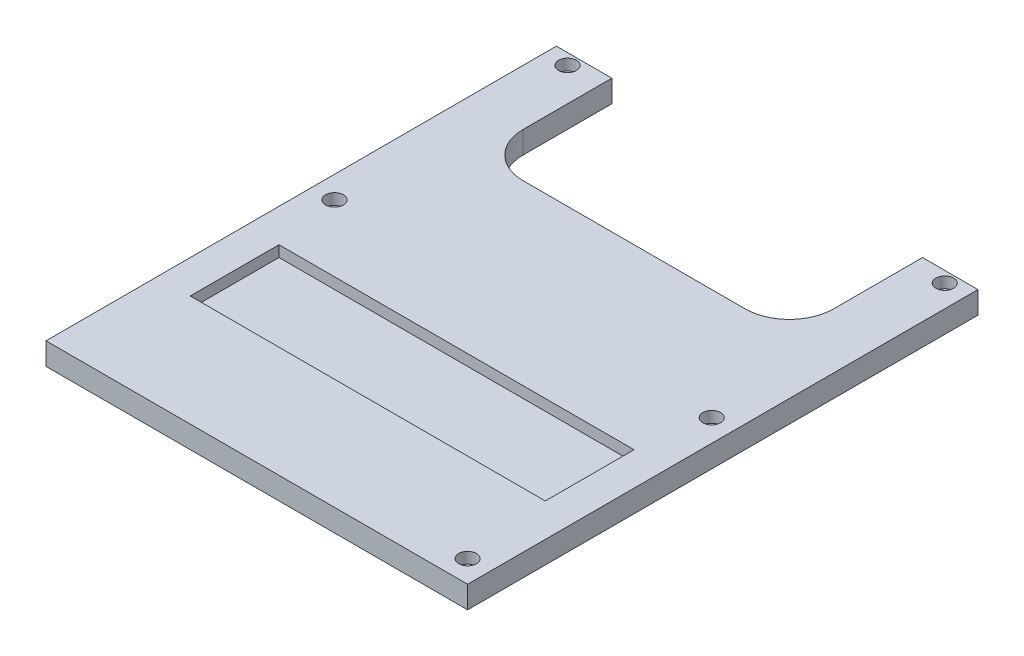
from build123d import *

# Parameters (mm, degrees)
SKETCH1_W                       = 120.65
SKETCH1_H                       = 146.05
BOSS_EXTRUDE1_DEPTH             = 6.35
SKETCH7_R                       = 2.54
CUT_EXTRUDE1_DEPTH              = 3.175
F_2_CLEARANCE_HOLE2_D           = 2.159
F_2_CLEARANCE_HOLE2_CSINK_D     = 3.429
F_2_CLEARANCE_HOLE2_CSINK_ANGLE = 75
SKETCH13_W                      = 88.9
SKETCH13_H                      = 38.1
CUT_EXTRUDE3_DEPTH              = 95.931969062
FILLET1_R                       = 12.7
SKETCH11_W                      = 101.6
SKETCH11_H                      = 25.4
CUT_EXTRUDE2_DEPTH              = 3.175


with BuildPart() as part:
    # Sketch1 → Boss-Extrude1 (new body)
    with BuildSketch(Plane(origin=(0, 0, 0), x_dir=(1, 0, 0), z_dir=(0, 1, 0))):
        Rectangle(SKETCH1_W, SKETCH1_H)
    extrude(amount=BOSS_EXTRUDE1_DEPTH)

    # Sketch7 → Cut-Extrude1 (cut)
    with BuildSketch(Plane(origin=(0, 6.35, 0), x_dir=(1, 0, 0), z_dir=(0, 1, 0))):
        with Locations(Location((-53.975, 3.175, 0), (0, 0, 270))):
            Circle(SKETCH7_R)
        with Locations(Location((53.975, 3.175, 0), (0, 0, 270))):
            Circle(SKETCH7_R)
        with Locations(Location((53.975, -66.675, 0), (0, 0, 270))):
            Circle(SKETCH7_R)
        with Locations(Location((-53.975, 69.85, 0), (0, 0, 270))):
            Circle(SKETCH7_R)
        with Locations(Location((53.975, 69.85, 0), (0, 0, 270))):
            Circle(SKETCH7_R)
    extrude(amount=-CUT_EXTRUDE1_DEPTH, mode=Mode.SUBTRACT)

    # #2 Clearance Hole2 (through all)
    with Locations(Plane(origin=(0, 3.175, 0), x_dir=(1, 0, 0), z_dir=(0, 1, 0))):
        with Locations((-53.975, 3.175), (53.975, 3.175), (53.975, -66.675), (-53.975, 69.85), (53.975, 69.85)):
            CounterSinkHole(F_2_CLEARANCE_HOLE2_D / 2, F_2_CLEARANCE_HOLE2_CSINK_D / 2, counter_sink_angle=F_2_CLEARANCE_HOLE2_CSINK_ANGLE)

    # Sketch13 → Cut-Extrude3 (cut, through all)
    with BuildSketch(Plane(origin=(0, 6.35, 0), x_dir=(1, 0, 0), z_dir=(0, 1, 0))):
        with Locations((0, 53.975)):
            Rectangle(SKETCH13_W, SKETCH13_H)
    extrude(amount=-CUT_EXTRUDE3_DEPTH, mode=Mode.SUBTRACT)

    # Fillet1
    fillet1_edges = [part.edges().sort_by_distance(p)[0] for p in [
        (44.45, 3.175, -34.925),
        (-44.45, 3.175, -34.925),
    ]]
    fillet(fillet1_edges, radius=FILLET1_R)

    # Sketch11 → Cut-Extrude2 (cut)
    with BuildSketch(Plane(origin=(0, 6.35, 0), x_dir=(1, 0, 0), z_dir=(0, 1, 0))):
        with Locations((0, -28.575)):
            Rectangle(SKETCH11_W, SKETCH11_H)
    extrude(amount=-CUT_EXTRUDE2_DEPTH, mode=Mode.SUBTRACT)


solid = part.part
